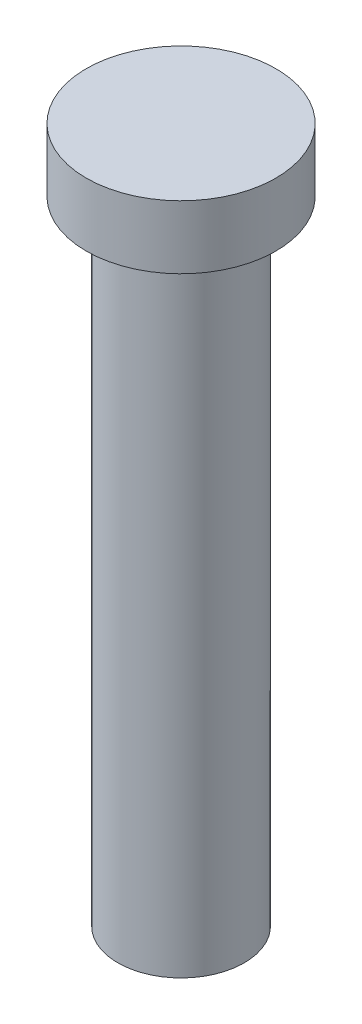
from build123d import *

# Parameters (mm, degrees)
SKETCH_1_R      = 2.25
EXTRUDE_1_DEPTH = 1.5
SKETCH_2_R      = 1.5
EXTRUDE_2_DEPTH = 15


with BuildPart() as part:
    # 草图1 → 凸台-拉伸1 (new body)
    with BuildSketch(Plane(origin=(0, 0, 0), x_dir=(1, 0, 0), z_dir=(0, 1, 0))):
        with Locations(Location((0, 0, 0), (0, 0, 270))):
            Circle(SKETCH_1_R)
    extrude(amount=EXTRUDE_1_DEPTH)

    # 草图2 → 凸台-拉伸2 (add)
    with BuildSketch(Plane.XZ):
        with Locations(Location((0, 0, 0), (0, 0, 270))):
            Circle(SKETCH_2_R)
    extrude(amount=EXTRUDE_2_DEPTH)


solid = part.part
